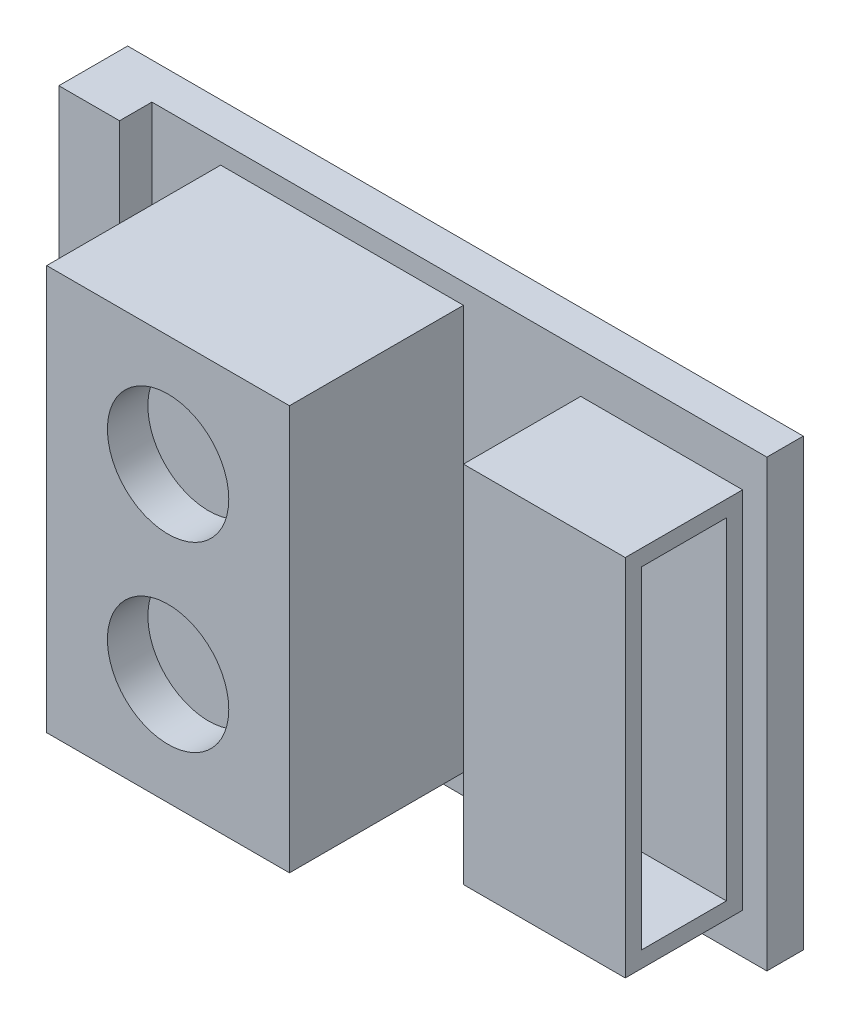
from build123d import *

# Parameters (mm, degrees)
ESBO_O1_W                = 16.7
ESBO_O1_H                = 11
RESSALTO_EXTRUS_O1_DEPTH = 5.2
ESBO_O2_W                = 16.7
ESBO_O2_H                = 11
ESBO_O2_W_2              = 6
ESBO_O2_H_2              = 10
ESBO_O2_W_3              = 4
ESBO_O2_H_3              = 9
CORTE_EXTRUS_O1_DEPTH    = 4.3
ESBO_O3_W                = 4
ESBO_O3_H                = 9
CORTE_EXTRUS_O2_DEPTH    = 1.4
ESBO_O4_R                = 1.5
CORTE_EXTRUS_O3_DEPTH    = 1
ESBO_O5_W                = 2.1
ESBO_O5_H                = 8.2
CORTE_EXTRUS_O4_DEPTH    = 3
ESBO_O6_W                = 1.5
ESBO_O6_H                = 11
RESSALTO_EXTRUS_O2_DEPTH = 0.8


with BuildPart() as part:
    # Esboço1 → Ressalto-extrusão1 (new body)
    with BuildSketch(Plane.XY):
        with Locations((3.068373494, 1.240361446)):
            Rectangle(ESBO_O1_W, ESBO_O1_H)
    extrude(amount=RESSALTO_EXTRUS_O1_DEPTH)

    # Esboço2 → Corte-extrusão1 (cut)
    with BuildSketch(Plane.XY.offset(5.2)):
        with Locations((3.068373494, 1.240361446)):
            Rectangle(ESBO_O2_W, ESBO_O2_H)
        with Locations((0.918373494, 1.240361446)):
            Rectangle(ESBO_O2_W_2, ESBO_O2_H_2, mode=Mode.SUBTRACT)
        with Locations((8.818373494, 1.240361446)):
            Rectangle(ESBO_O2_W_3, ESBO_O2_H_3, mode=Mode.SUBTRACT)
    extrude(amount=-CORTE_EXTRUS_O1_DEPTH, mode=Mode.SUBTRACT)

    # Esboço3 → Corte-extrusão2 (cut)
    with BuildSketch(Plane.XY.offset(5.2)):
        with Locations((8.818373494, 1.240361446)):
            Rectangle(ESBO_O3_W, ESBO_O3_H)
    extrude(amount=-CORTE_EXTRUS_O2_DEPTH, mode=Mode.SUBTRACT)

    # Esboço4 → Corte-extrusão3 (cut)
    with BuildSketch(Plane.XY.offset(5.2)):
        with Locations((0.918373494, 3.490361446)):
            Circle(ESBO_O4_R)
        with Locations((0.918373494, -1.009638554)):
            Circle(ESBO_O4_R)
    extrude(amount=-CORTE_EXTRUS_O3_DEPTH, mode=Mode.SUBTRACT)

    # Esboço5 → Corte-extrusão4 (cut)
    with BuildSketch(Plane(origin=(10.818373494, 0, 0), x_dir=(0, 0, -1), z_dir=(1, 0, 0))):
        with Locations((-2.35, 1.240361446)):
            Rectangle(ESBO_O5_W, ESBO_O5_H)
    extrude(amount=-CORTE_EXTRUS_O4_DEPTH, mode=Mode.SUBTRACT)

    # Esboço6 → Ressalto-extrusão2 (add)
    with BuildSketch(Plane.XY.offset(0.9)):
        with Locations((-4.531626506, 1.240361446)):
            Rectangle(ESBO_O6_W, ESBO_O6_H)
    extrude(amount=RESSALTO_EXTRUS_O2_DEPTH)


solid = part.part
